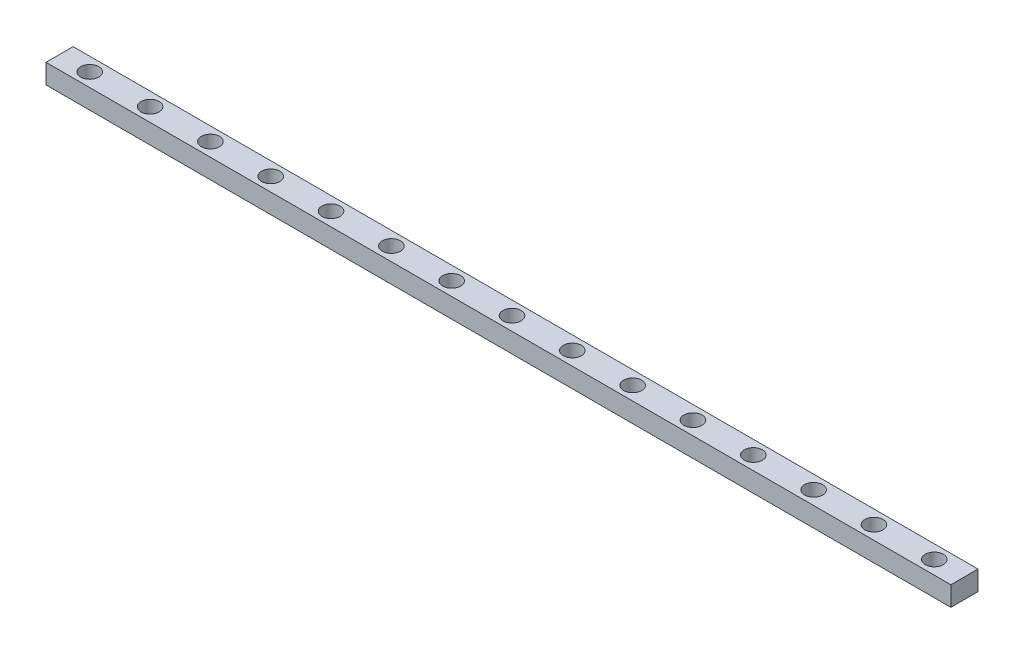
from build123d import *

# Parameters (mm, degrees)
SKETCH1_W           = 9
SKETCH1_H           = 6.5
BOSS_EXTRUDE1_DEPTH = 150
SKETCH2_R           = 1.75
CUT_EXTRUDE1_DEPTH  = 151.208188858
SKETCH3_R           = 3
CUT_EXTRUDE2_DEPTH  = 4.5
LPATTERN1_COUNT     = 8
LPATTERN1_PITCH     = 20
LPATTERN1_COL_COUNT = 8
LPATTERN1_COL_PITCH = 20


with BuildPart() as part:
    # Sketch1 → Boss-Extrude1 (new, symmetric)
    with BuildSketch(Plane(origin=(0, 0, 0), x_dir=(0, 0, -1), z_dir=(1, 0, 0))):
        Rectangle(SKETCH1_W, SKETCH1_H)
    extrude(amount=BOSS_EXTRUDE1_DEPTH, both=True)

    # Sketch2 → Cut-Extrude1 (cut, through all)
    with BuildSketch(Plane(origin=(0, 3.25, 0), x_dir=(1, 0, 0), z_dir=(0, 1, 0))):
        with Locations(Location((0, 0, 0), (0, 0, 270))):
            Circle(SKETCH2_R)
    cut_extrude1 = extrude(amount=-CUT_EXTRUDE1_DEPTH, mode=Mode.SUBTRACT)

    # Sketch3 → Cut-Extrude2 (cut)
    with BuildSketch(Plane(origin=(0, 3.25, 0), x_dir=(1, 0, 0), z_dir=(0, 1, 0))):
        with Locations(Location((0, 0, 0), (0, 0, 270))):
            Circle(SKETCH3_R)
    cut_extrude2 = extrude(amount=-CUT_EXTRUDE2_DEPTH, mode=Mode.SUBTRACT)

    # LPattern1: Cut-Extrude1, Cut-Extrude2 ×8
    with Locations(*[(-i * LPATTERN1_PITCH, 0, 0) for i in range(1, LPATTERN1_COUNT)]):
        add(cut_extrude1, mode=Mode.SUBTRACT)
        add(cut_extrude2, mode=Mode.SUBTRACT)

    # LPattern1 col: Cut-Extrude1, Cut-Extrude2 ×8
    with Locations(*[(i * LPATTERN1_COL_PITCH, 0, 0) for i in range(1, LPATTERN1_COL_COUNT)]):
        add(cut_extrude1, mode=Mode.SUBTRACT)
        add(cut_extrude2, mode=Mode.SUBTRACT)


solid = part.part
